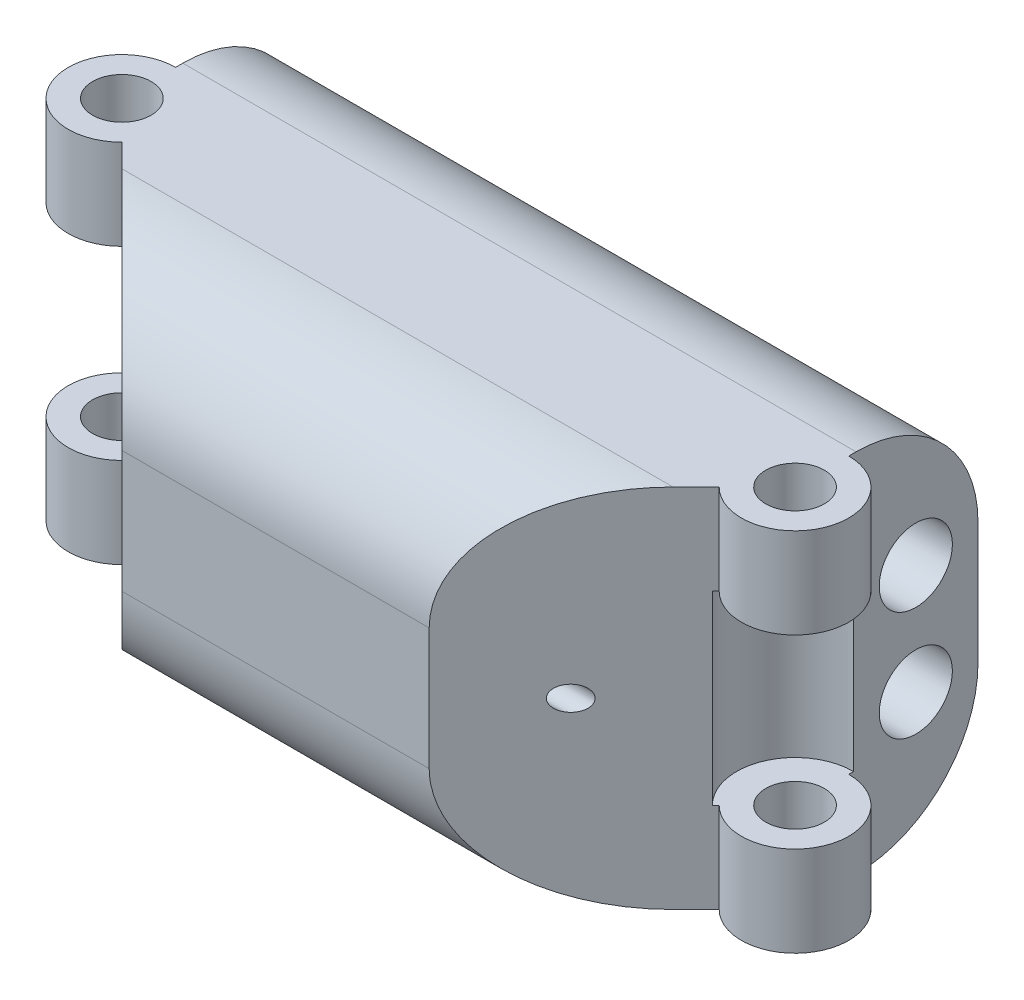
from build123d import *

# Parameters (mm, degrees)
BOSS_EXTRUDE1_DEPTH            = 7.5
BOSS_EXTRUDE1_DEPTH_BACK       = 7.5
CUT_EXTRUDE3_REACH             = 31.568
SKETCH5_R                      = 1.5
FILLET1_R                      = 5
CUT_EXTRUDE2_REACH             = 19.405
SKETCH3_R                      = 0.5
CUT_EXTRUDE2_DIRECTION_2_REACH = 19.405
FILLET2_R                      = 5
BOSS_EXTRUDE2_START            = 3.8
SKETCH6_R                      = 1.2
BOSS_EXTRUDE2_DEPTH            = 3.7
BOSS_EXTRUDE3_START            = -7.5
SKETCH6_4_R                    = 1.2
BOSS_EXTRUDE3_DEPTH            = 3.7


with BuildPart() as part:
    # Sketch1 → Boss-Extrude1 (new, two sides: drawn at the far end of the back side and taken through both)
    with BuildSketch(Plane(origin=(0, 0, 0), x_dir=(-1, 0, 0), z_dir=(0, 1, 0)).offset(-BOSS_EXTRUDE1_DEPTH_BACK)):
        with BuildLine():
            Line((6.3, 7.5), (-6.3, 7.5))
            Line((-6.3, 7.5), (-12.102943725, 1.697056275))
            ThreePointArc((-12.102943725, 1.697056275), (-11.582689122, -0.918440238), (-13.8, -2.4))
            Line((-13.8, -2.4), (-13.8, -7.5))
            Line((-13.8, -7.5), (13.8, -7.5))
            Line((13.8, -7.5), (13.8, -2.4))
            ThreePointArc((13.8, -2.4), (11.582689122, -0.918440238), (12.102943725, 1.697056275))
            Line((12.102943725, 1.697056275), (6.3, 7.5))
        make_face()
    extrude(amount=BOSS_EXTRUDE1_DEPTH + BOSS_EXTRUDE1_DEPTH_BACK)

    # Sketch5 → Cut-Extrude3 (cut, up to next)
    with BuildSketch(Plane.YZ.offset(13.8), mode=Mode.PRIVATE) as cut_extrude3_sk1:
        with Locations((-2.25, -4.95)):
            Circle(SKETCH5_R)
    cut_extrude3_tool1 = extrude(cut_extrude3_sk1.sketch, amount=-CUT_EXTRUDE3_REACH, mode=Mode.PRIVATE) & part.part
    # Sketch5 → Cut-Extrude3 (cut, up to next)
    with BuildSketch(Plane.YZ.offset(13.8), mode=Mode.PRIVATE) as cut_extrude3_sk2:
        with Locations((2.25, -4.95)):
            Circle(SKETCH5_R)
    cut_extrude3_tool2 = extrude(cut_extrude3_sk2.sketch, amount=-CUT_EXTRUDE3_REACH, mode=Mode.PRIVATE) & part.part
    add(cut_extrude3_tool1.solids().sort_by_distance((13.8, -2.25, -4.95))[0], mode=Mode.SUBTRACT)
    add(cut_extrude3_tool2.solids().sort_by_distance((13.8, 2.25, -4.95))[0], mode=Mode.SUBTRACT)

    # Fillet1
    fillet1_edges = [part.edges().sort_by_distance(p)[0] for p in [
        (0, -7.5, -7.5),
        (0, 7.5, -7.5),
    ]]
    fillet(fillet1_edges, radius=FILLET1_R)

    # Sketch3 → Cut-Extrude2 (cut, up to next)
    with BuildSketch(Plane.YZ, mode=Mode.PRIVATE) as cut_extrude2_sk1:
        with Locations((0, 4.598528137)):
            Circle(SKETCH3_R)
    cut_extrude2_tool1 = extrude(cut_extrude2_sk1.sketch, amount=-CUT_EXTRUDE2_REACH, mode=Mode.PRIVATE) & part.part
    add(cut_extrude2_tool1.solids().sort_by_distance((0, 0, 4.598528))[0], mode=Mode.SUBTRACT)

    # Sketch3 → Cut-Extrude2 direction 2 (cut, up to next)
    with BuildSketch(Plane.YZ, mode=Mode.PRIVATE) as cut_extrude2_direction_2_sk1:
        with Locations((0, 4.598528137)):
            Circle(SKETCH3_R)
    cut_extrude2_direction_2_tool1 = extrude(cut_extrude2_direction_2_sk1.sketch, amount=CUT_EXTRUDE2_DIRECTION_2_REACH, mode=Mode.PRIVATE) & part.part
    add(cut_extrude2_direction_2_tool1.solids().sort_by_distance((0, 0, 4.598528))[0], mode=Mode.SUBTRACT)

    # Fillet2
    fillet2_edges = [part.edges().sort_by_distance(p)[0] for p in [
        (0, 7.5, 7.5),
        (0, -7.5, 7.5),
    ]]
    fillet(fillet2_edges, radius=FILLET2_R)

    # Sketch6 → Boss-Extrude2 (add)
    # profile 1 of 2: a face of its own
    with BuildSketch(Plane(origin=(0, 0, 0), x_dir=(-1, 0, 0), z_dir=(0, 1, 0)).offset(BOSS_EXTRUDE2_START)):
        with BuildLine():
            Line((-12.102943725, 1.697056275), (-12.244365081, 1.555634919))
            ThreePointArc((-12.244365081, 1.555634919), (-15.832534972, 0.841903551), (-13.8, -2.2))
            Line((-13.8, -2.2), (-13.8, -2.4))
            ThreePointArc((-13.8, -2.4), (-11.582689122, -0.918440238), (-12.102943725, 1.697056275))
        make_face()
        with Locations((-13.8, 0)):
            Circle(SKETCH6_R, mode=Mode.SUBTRACT)
    # profile 2 of 2: a face of its own
    with BuildSketch(Plane(origin=(0, 0, 0), x_dir=(-1, 0, 0), z_dir=(0, 1, 0)).offset(BOSS_EXTRUDE2_START)):
        with BuildLine():
            Line((13.8, -2.4), (13.8, -2.2))
            ThreePointArc((13.8, -2.2), (15.832534972, 0.841903551), (12.244365081, 1.555634919))
            Line((12.244365081, 1.555634919), (12.102943725, 1.697056275))
            ThreePointArc((12.102943725, 1.697056275), (11.582689122, -0.918440238), (13.8, -2.4))
        make_face()
        with Locations((13.8, 0)):
            Circle(SKETCH6_R, mode=Mode.SUBTRACT)
    extrude(amount=BOSS_EXTRUDE2_DEPTH)

    # Sketch6<4> → Boss-Extrude3 (add)
    # profile 1 of 2: a face of its own
    with BuildSketch(Plane(origin=(0, 0, 0), x_dir=(-1, 0, 0), z_dir=(0, 1, 0)).offset(BOSS_EXTRUDE3_START)):
        with BuildLine():
            Line((-12.102943725, 1.697056275), (-12.244365081, 1.555634919))
            ThreePointArc((-12.244365081, 1.555634919), (-15.832534972, 0.841903551), (-13.8, -2.2))
            Line((-13.8, -2.2), (-13.8, -2.4))
            ThreePointArc((-13.8, -2.4), (-11.582689122, -0.918440238), (-12.102943725, 1.697056275))
        make_face()
        with Locations((-13.8, 0)):
            Circle(SKETCH6_4_R, mode=Mode.SUBTRACT)
    # profile 2 of 2: a face of its own
    with BuildSketch(Plane(origin=(0, 0, 0), x_dir=(-1, 0, 0), z_dir=(0, 1, 0)).offset(BOSS_EXTRUDE3_START)):
        with BuildLine():
            Line((13.8, -2.4), (13.8, -2.2))
            ThreePointArc((13.8, -2.2), (15.832534972, 0.841903551), (12.244365081, 1.555634919))
            Line((12.244365081, 1.555634919), (12.102943725, 1.697056275))
            ThreePointArc((12.102943725, 1.697056275), (11.582689122, -0.918440238), (13.8, -2.4))
        make_face()
        with Locations((13.8, 0)):
            Circle(SKETCH6_4_R, mode=Mode.SUBTRACT)
    extrude(amount=BOSS_EXTRUDE3_DEPTH)


solid = part.part
